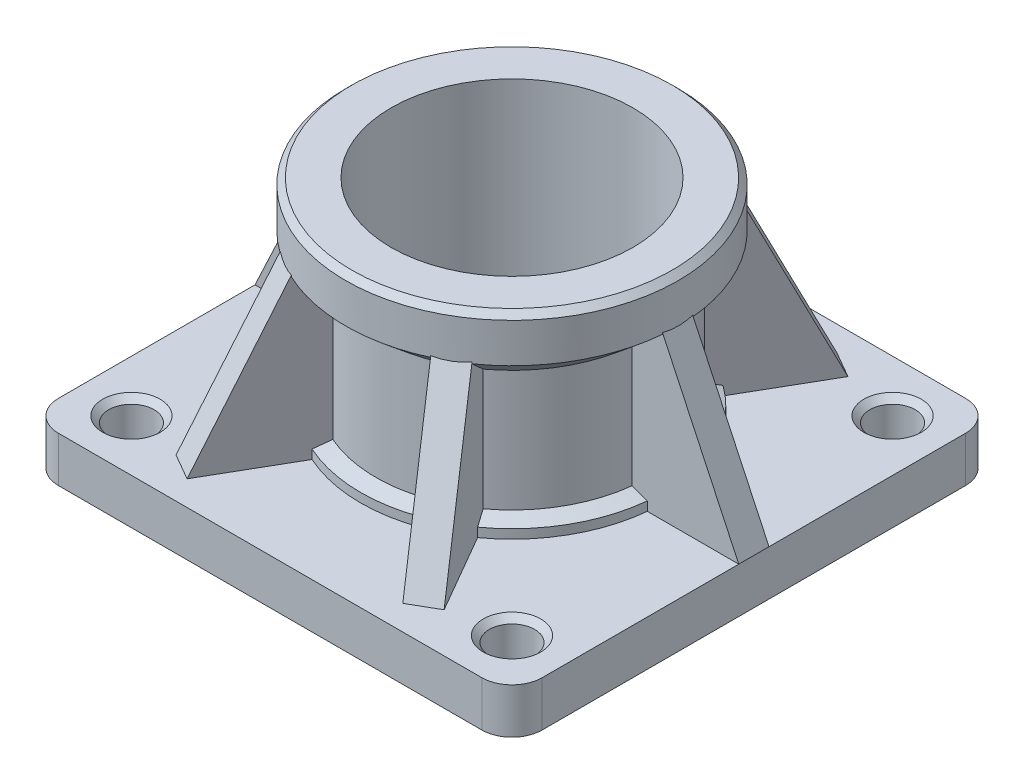
from build123d import *

# Parameters (mm, degrees)
BASE_SKETCH_W               = 203.2
BASE_SKETCH_H               = 203.2
BASE_FEATURE_DEPTH          = 19.05
SHAFT_HOLE_SKETCH_R         = 50.8
SHAFT_HOLE_FEATURE_DEPTH    = 179.361745911
BASE_FILLET_R               = 12.7
BOLTING_HOLES_SKETCH_R      = 9.525
BOLTING_HOLES_FEATURE_DEPTH = 168.778102347
RIB_SUPPORT_FEATURE_REACH   = 180.362
RIB_SUPPORT_SKETCH_WALL_W   = 433.38819801
RIB_SUPPORT_SKETCH_WALL_H   = 12.7
RIB_SUPPORT_PATTERN_COUNT   = 6
CHAMFER1_SIZE               = 2.54


with BuildPart() as part:
    # Base Sketch → Base Feature (new body)
    with BuildSketch(Plane(origin=(0, 0, 0), x_dir=(1, 0, 0), z_dir=(0, 1, 0))):
        Rectangle(BASE_SKETCH_W, BASE_SKETCH_H)
    extrude(amount=BASE_FEATURE_DEPTH)

    # Shaft Housing Sketch → Shaft Housing Feature (revolve)
    with BuildSketch(Plane.XY, mode=Mode.PRIVATE) as shaft_housing_feature_sk:
        Polygon((63.5, 19.05), (63.5, 22.86), (57.15, 25.171210988), (57.15, 75.971210988), (69.85, 86.627776304), (69.85, 105.677776304), (50.8, 105.677776304), (50.8, 19.05), align=None)
    revolve(shaft_housing_feature_sk.sketch.rotate(Axis((0, 0, 0), (0, -1, 0)), 90), axis=Axis((0, 0, 0), (0, -1, 0)))

    # Shaft Hole Sketch → Shaft Hole Feature (cut, through all)
    with BuildSketch(Plane(origin=(0, 105.677776304, 0), x_dir=(1, 0, 0), z_dir=(0, 1, 0))):
        with Locations(Location((0, 0, 0), (0, 0, 270))):
            Circle(SHAFT_HOLE_SKETCH_R)
    extrude(amount=-SHAFT_HOLE_FEATURE_DEPTH, mode=Mode.SUBTRACT)

    # Base Fillet
    base_fillet_edges = [part.edges().sort_by_distance(p)[0] for p in [
        (-101.6, 9.525, -101.6),
        (101.6, 9.525, -101.6),
        (101.6, 9.525, 101.6),
        (-101.6, 9.525, 101.6),
    ]]
    fillet(base_fillet_edges, radius=BASE_FILLET_R)

    # Bolting Holes Sketch → Bolting Holes Feature (cut, through all)
    with BuildSketch(Plane(origin=(0, 19.05, 0), x_dir=(1, 0, 0), z_dir=(0, 1, 0))):
        with Locations(Location((-79.919743879, 79.919743879, 0), (0, 0, 270))):
            Circle(BOLTING_HOLES_SKETCH_R)
        with Locations(Location((79.919743879, 79.919743879, 0), (0, 0, 270))):
            Circle(BOLTING_HOLES_SKETCH_R)
        with Locations(Location((79.919743879, -79.919743879, 0), (0, 0, 270))):
            Circle(BOLTING_HOLES_SKETCH_R)
        with Locations(Location((-79.919743879, -79.919743879, 0), (0, 0, 270))):
            Circle(BOLTING_HOLES_SKETCH_R)
    extrude(amount=-BOLTING_HOLES_FEATURE_DEPTH, mode=Mode.SUBTRACT)

    # Rib Support Sketch wall → Rib Support Feature (add, up to next)
    with BuildSketch(Plane(origin=(-85.725, 52.838888152, 0), x_dir=(-0.425234379412, -0.905083268305, 0), z_dir=(0.905083268305, -0.425234379412, 0)), mode=Mode.PRIVATE) as rib_support_feature_sk1:
        Rectangle(RIB_SUPPORT_SKETCH_WALL_W, RIB_SUPPORT_SKETCH_WALL_H)
    rib_support_feature_tool1 = extrude(rib_support_feature_sk1.sketch, amount=RIB_SUPPORT_FEATURE_REACH, mode=Mode.PRIVATE) - part.part
    rib_support_feature = rib_support_feature_tool1.solids().sort_by_distance((-85.725, 52.838888152, 0))[0]
    add(rib_support_feature)

    # Rib Support Pattern: Rib Support Feature ×6 about axis
    rib_support_pattern_axis = Axis((0, 0, 0), (0, 1, 0))
    for i in range(1, RIB_SUPPORT_PATTERN_COUNT):
        add(rib_support_feature.rotate(rib_support_pattern_axis, i * 360 / RIB_SUPPORT_PATTERN_COUNT))

    # Chamfer1
    chamfer1_edges = [part.edges().sort_by_distance(p)[0] for p in [
        (0, 105.677776304, -69.85),
        (-79.919743879, 19.05, -89.444743879),
        (79.919743879, 19.05, -89.444743879),
        (79.919743879, 19.05, 70.394743879),
        (-79.919743879, 19.05, 70.394743879),
    ]]
    chamfer(chamfer1_edges, length=CHAMFER1_SIZE)


solid = part.part
